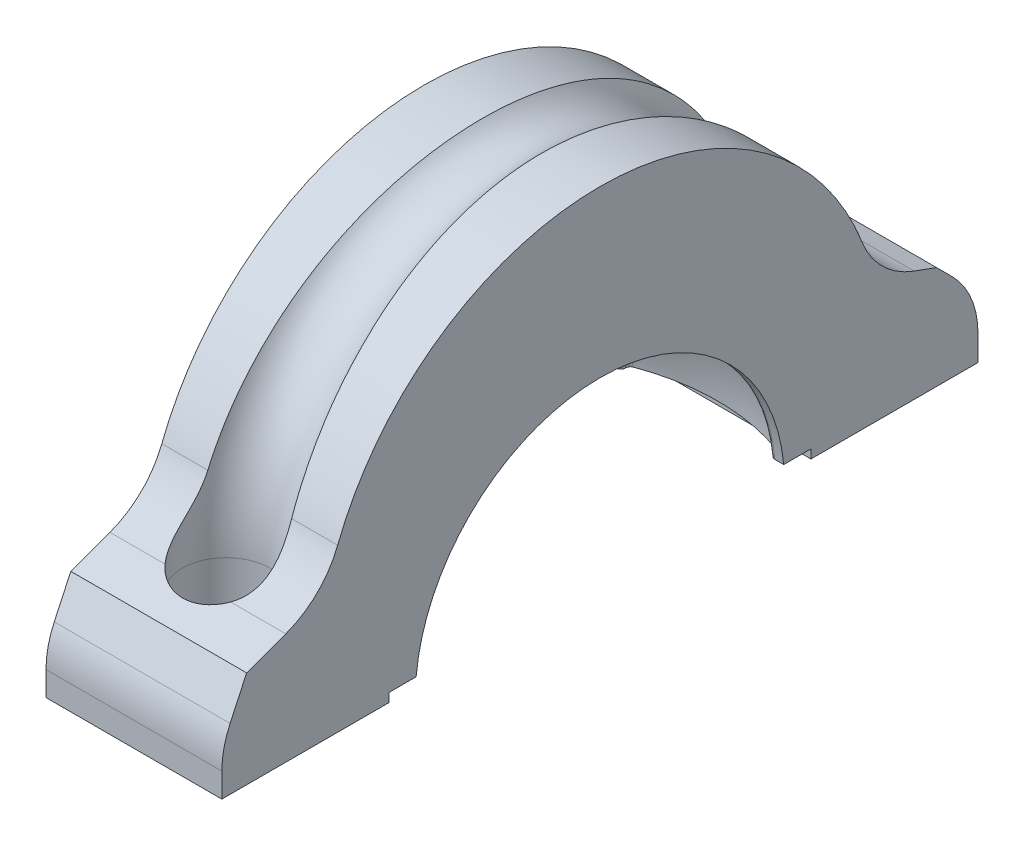
from build123d import *
from OCP.BRepFilletAPI import BRepFilletAPI_MakeChamfer

# Parameters (mm, degrees)
BOSS_EXTRUDE1_DEPTH = 20
FILLET1_R           = 10
CHAMFER1_SIZE       = 3
CHAMFER1_SIZE2      = 5.019471555
SKETCH5_R           = 5
FILLET4_R           = 10
FILLET5_R           = 0.5


with BuildPart() as part:
    # Sketch1 → Boss-Extrude1 (new body)
    with BuildSketch(Plane(origin=(0, 0, 0), x_dir=(0, 0, -1), z_dir=(1, 0, 0))):
        with BuildLine():
            Line((-86, 0), (-67, 0))
            Line((-67, 0), (-67, 1))
            Line((-67, 1), (-19, 1))
            Line((-19, 1), (-19, 0))
            Line((-19, 0), (0, 0))
            Line((0, 0), (0, 10))
            Line((0, 10), (-11.889492676, 14.327421434))
            ThreePointArc((-11.889492676, 14.327421434), (-43, 38.835002999), (-74.110507324, 14.327421434))
            Line((-74.110507324, 14.327421434), (-86, 10))
            Line((-86, 10), (-86, 0))
        make_face()
    extrude(amount=BOSS_EXTRUDE1_DEPTH)

    # Fillet1
    fillet1_edges = [part.edges().sort_by_distance(p)[0] for p in [
        (10, 14.327421434, 74.110507324),
        (10, 14.327421434, 11.889492676),
    ]]
    fillet(fillet1_edges, radius=FILLET1_R)

    # Chamfer1: one chamfer whose edges measure the first distance from different faces: ONE call of the kernel's chamfer builder (chamfer() names one face for all edges)
    chamfer1_edges_1 = [part.edges().sort_by_distance(p)[0] for p in [
        (10, 10, 86),
    ]]
    chamfer1_side_1 = [part.faces().sort_by_distance(p)[0] for p in [
        (10, 11.323089013, 82.364842814),
    ]]
    chamfer1_edges_2 = [part.edges().sort_by_distance(p)[0] for p in [
        (10, 10, 0),
    ]]
    chamfer1_side_2 = [part.faces().sort_by_distance(p)[0] for p in [
        (10, 5, 0),
    ]]
    chamfer1 = BRepFilletAPI_MakeChamfer(part.part.solid().wrapped)
    for e in chamfer1_edges_1:
        chamfer1.Add(CHAMFER1_SIZE, CHAMFER1_SIZE2, e.wrapped, chamfer1_side_1[0].wrapped)  # the first distance lies on this face
    for e in chamfer1_edges_2:
        chamfer1.Add(CHAMFER1_SIZE, CHAMFER1_SIZE2, e.wrapped, chamfer1_side_2[0].wrapped)  # the first distance lies on this face
    add(Compound.cast(chamfer1.Shape()), mode=Mode.REPLACE)

    # augu cut: sweep along a path in Sketch2
    with BuildLine(Plane(origin=(10, 0, 0), x_dir=(0, 0, -1), z_dir=(1, 0, 0))) as augu_cut_path:
        Line((-10.5, -11.403017839), (-10.5, 10))
        ThreePointArc((-10.5, 10), (-43, 42.5), (-75.5, 10))
        Line((-75.5, 10), (-75.5, -11.403017839))
    # Sketch5 → augu cut (sweep, cut)
    with BuildSketch(Plane(origin=(0, -11.403017839, 0), x_dir=(-1, 0, 0), z_dir=(0, -1, 0))):
        with Locations((-10, -10.5)):
            Circle(SKETCH5_R)
    sweep(path=augu_cut_path.line, mode=Mode.SUBTRACT)

    # Sketch6 → Cut-Revolve2 (revolve, cut)
    with BuildSketch(Plane.XZ.offset(1)):
        with BuildLine():
            Line((0, 64), (1.5, 64))
            Line((1.5, 64), (1.5, 64.9089023))
            ThreePointArc((1.5, 64.9089023), (10, 66.5), (18.5, 64.9089023))
            Line((18.5, 64.9089023), (18.5, 64))
            Line((18.5, 64), (20, 64))
            Line((20, 64), (20, 43))
            Line((20, 43), (0, 43))
            Line((0, 43), (0, 64))
        make_face()
    revolve(axis=Axis((0, -1, 43), (1, 0, 0)), mode=Mode.SUBTRACT)

    # Fillet4
    fillet4_edges = [part.edges().sort_by_distance(p)[0] for p in [
        (10, 7, 0),
        (10, 4.980528445, 86),
    ]]
    fillet(fillet4_edges, radius=FILLET4_R)

    # Fillet5
    fillet5_edges = [part.edges().sort_by_distance(p)[0] for p in [
        (1.5, 20.9089023, 43),
        (18.5, 20.9089023, 43),
        (18.5, 20, 43),
        (1.5, 20, 43),
    ]]
    fillet(fillet5_edges, radius=FILLET5_R)


solid = part.part
